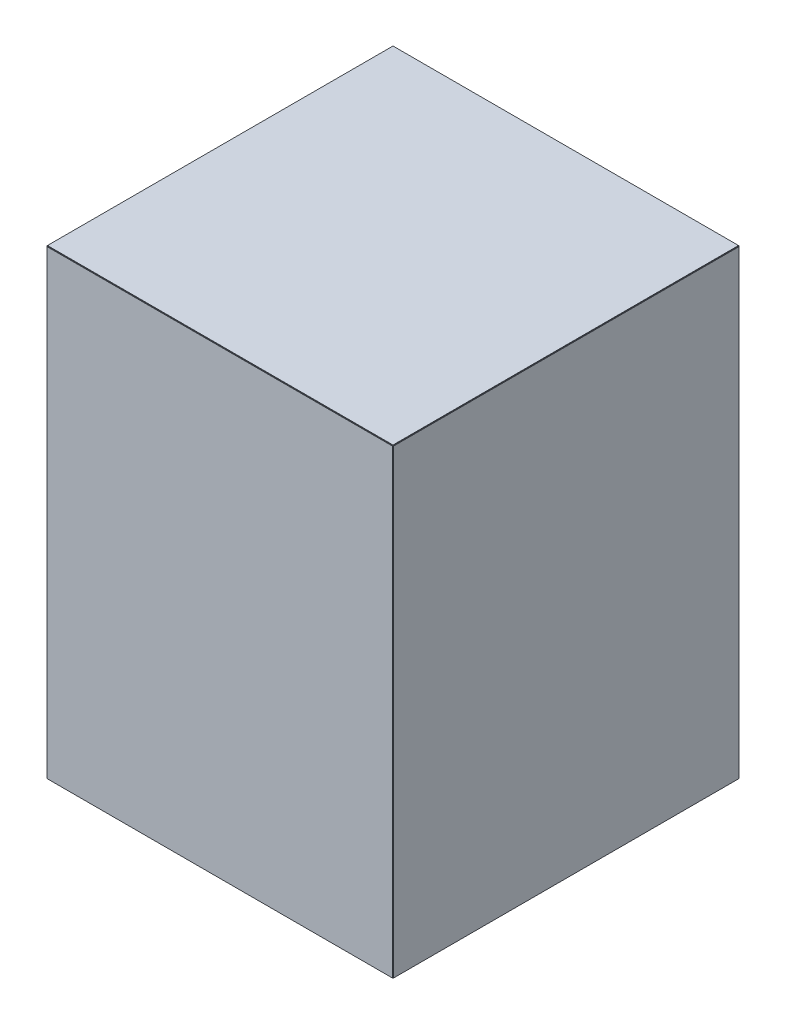
from build123d import *

# Parameters (mm, degrees)
SKETCH14_W                                   = 1828.8
SKETCH14_H                                   = 1828.8
BOSS_EXTRUDE20_DEPTH                         = 3.175
SKETCH13_W                                   = 1828.8
SKETCH13_H                                   = 2438.4
ILLUMINANCE_PLANE_1_15_2019_3_02_36_PM_DEPTH = 3.175
SKETCH12_W                                   = 1828.8
SKETCH12_H                                   = 2438.4
BOSS_EXTRUDE18_DEPTH                         = 3.175
SKETCH11_W                                   = 1828.8
SKETCH11_H                                   = 2438.4
BOSS_EXTRUDE16_DEPTH                         = 3.175
SKETCH2_W                                    = 1828.8
SKETCH2_H                                    = 2438.4
BOSS_EXTRUDE5_DEPTH                          = 3.175


with BuildPart() as part:
    # Sketch14 → Boss-Extrude20 (new body)
    with BuildSketch(Plane(origin=(0, 1219.2, 0), x_dir=(1, 0, 0), z_dir=(0, 1, 0))):
        Rectangle(SKETCH14_W, SKETCH14_H)
    extrude(amount=BOSS_EXTRUDE20_DEPTH)


with BuildPart() as body_2:
    # Sketch13 → Illuminance Plane 1-15-2019 3_02_36 PM (new body)
    with BuildSketch(Plane(origin=(0, 0, -914.4), x_dir=(-1, 0, 0), z_dir=(0, 0, -1))):
        Rectangle(SKETCH13_W, SKETCH13_H)
    extrude(amount=ILLUMINANCE_PLANE_1_15_2019_3_02_36_PM_DEPTH)


with BuildPart() as body_3:
    # Sketch12 → Boss-Extrude18 (new body)
    with BuildSketch(Plane.ZY.offset(914.4)):
        Rectangle(SKETCH12_W, SKETCH12_H)
    extrude(amount=BOSS_EXTRUDE18_DEPTH)


with BuildPart() as body_4:
    # Sketch11 → Boss-Extrude16 (new body)
    with BuildSketch(Plane(origin=(914.4, 0, 0), x_dir=(0, 0, -1), z_dir=(1, 0, 0))):
        Rectangle(SKETCH11_W, SKETCH11_H)
    extrude(amount=BOSS_EXTRUDE16_DEPTH)


with BuildPart() as body_5:
    # Sketch2 → Boss-Extrude5 (new body)
    with BuildSketch(Plane.XY.offset(914.4)):
        Rectangle(SKETCH2_W, SKETCH2_H)
    extrude(amount=BOSS_EXTRUDE5_DEPTH)


solid = Compound([part.part, body_2.part, body_3.part, body_4.part, body_5.part])
